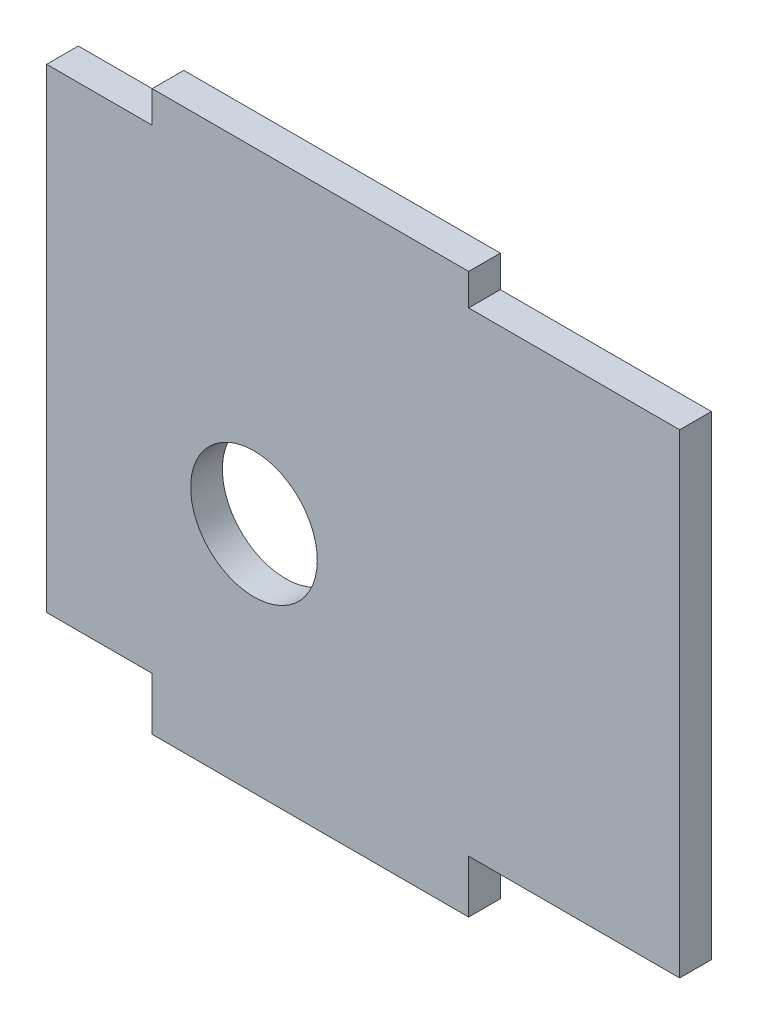
from build123d import *

# Parameters (mm, degrees)
SCHIZZO1_W                   = 30
SCHIZZO1_H                   = 53
ESTRUSIONE_ESTRUSIONE1_DEPTH = 3
SCHIZZO3_W                   = 10
SCHIZZO3_H                   = 45
SCHIZZO3_W_2                 = 20
ESTRUSIONE_ESTRUSIONE2_DEPTH = 3
SCHIZZO5_R                   = 6
TAGLIO_ESTRUSIONE1_DEPTH     = 85.055041491


with BuildPart() as part:
    # Schizzo1 → Estrusione-Estrusione1 (new body)
    with BuildSketch(Plane.XY):
        with Locations((32.5, -23.5)):
            Rectangle(SCHIZZO1_W, SCHIZZO1_H)
    extrude(amount=ESTRUSIONE_ESTRUSIONE1_DEPTH)

    # Schizzo3 → Estrusione-Estrusione2 (add)
    with BuildSketch(Plane.XY.offset(3)):
        with Locations((12.5, -22.5)):
            Rectangle(SCHIZZO3_W, SCHIZZO3_H)
        with Locations((57.5, -22.5)):
            Rectangle(SCHIZZO3_W_2, SCHIZZO3_H)
    extrude(amount=-ESTRUSIONE_ESTRUSIONE2_DEPTH)

    # Schizzo5 → Taglio-Estrusione1 (cut, through all)
    with BuildSketch(Plane.XY.offset(3)):
        with Locations((27.15, -27.9)):
            Circle(SCHIZZO5_R)
    extrude(amount=-TAGLIO_ESTRUSIONE1_DEPTH, mode=Mode.SUBTRACT)


solid = part.part
